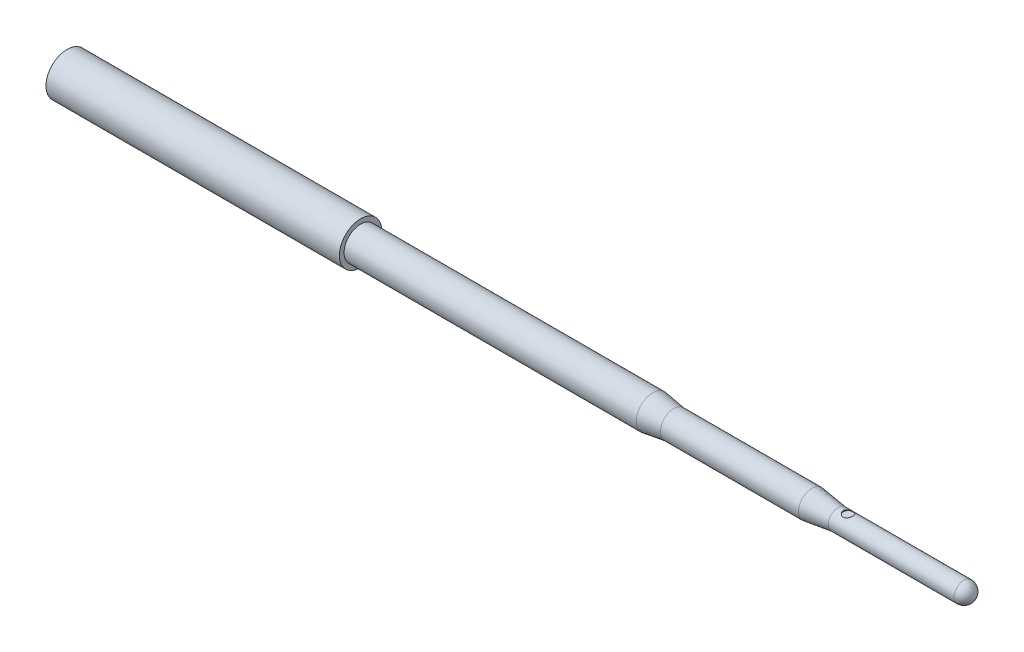
from build123d import *

# Parameters (mm, degrees)
BOSS_EXTRUDE1_START = 2.8702
SKETCH3_R           = 2.8702
BOSS_EXTRUDE1_DEPTH = 2.8702
FILLET1_R           = 2.8702
CUT_EXTRUDE1_START  = 2.54
SKETCH4_R           = 1.397
CUT_EXTRUDE1_DEPTH  = 2.54


with BuildPart() as part:
    # Sketch1 → Revolve1 (revolve)
    with BuildSketch(Plane(origin=(0, 0, 0), x_dir=(1, 0, 0), z_dir=(0, 1, 0))):
        Polygon((-36.261655476, 25.478138479), (-30.153813644, 24.589138479), (9.800386356, 24.589138479), (17.401896005, 23.560438479), (53.800096005, 23.560438479), (53.800096005, 20.690238479), (-205.705055476, 20.690238479), (-205.705055476, 26.824338479), (-120.792855476, 26.824338479), (-120.792855476, 25.478138479), align=None)
    revolve(axis=Axis((53.800096005, 0, -20.690238479), (-1, 0, 0)))

    # Sketch3 → Boss-Extrude1 (add)
    with BuildSketch(Plane(origin=(53.800096005, 0, 0), x_dir=(0, 0, -1), z_dir=(1, 0, 0)).offset(BOSS_EXTRUDE1_START)):
        with Locations((20.690238479, 0)):
            Circle(SKETCH3_R)
    extrude(amount=-BOSS_EXTRUDE1_DEPTH)

    # Fillet1
    fillet1_edges = [part.edges().sort_by_distance(p)[0] for p in [
        (56.670296005, 0, -17.820038479),
    ]]
    fillet(fillet1_edges, radius=FILLET1_R)

    # Sketch4 → Cut-Extrude1 (cut)
    with BuildSketch(Plane(origin=(0, 0, 0), x_dir=(1, 0, 0), z_dir=(0, 1, 0)).offset(CUT_EXTRUDE1_START)):
        with Locations((20.272096005, 20.690238479)):
            Circle(SKETCH4_R)
    extrude(amount=CUT_EXTRUDE1_DEPTH, mode=Mode.SUBTRACT)


solid = part.part
